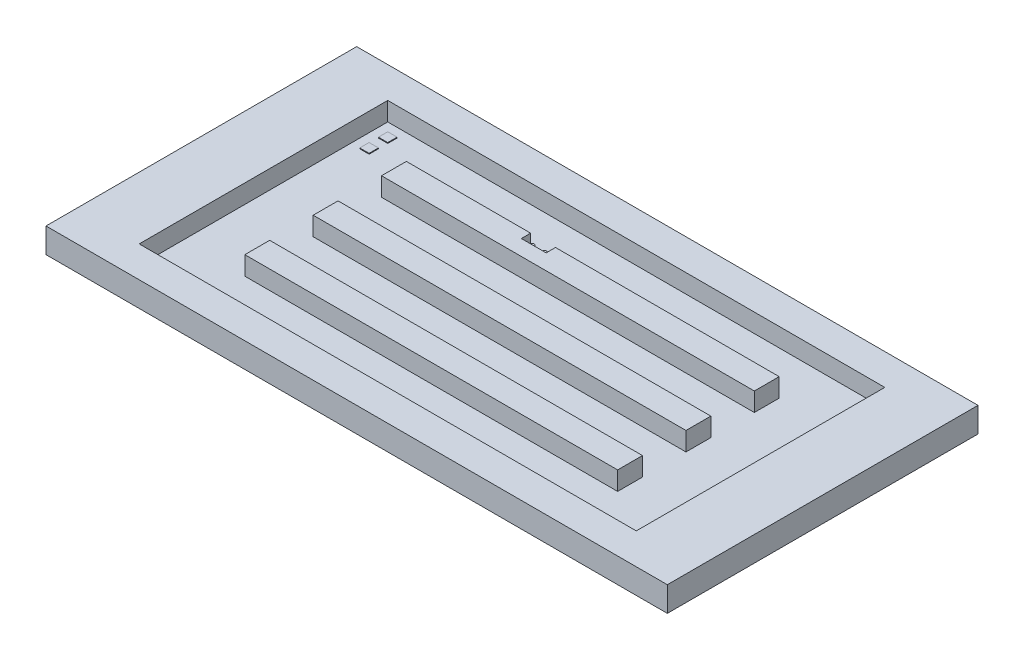
from build123d import *

# Parameters (mm, degrees)
SKETCH_1_W          = 10000
SKETCH_1_H          = 5000
EXTRUDE_1_DEPTH     = 400
SKETCH_2_W          = 8000
SKETCH_2_H          = 4000
SKETCH_2_W_2        = 6000
SKETCH_2_H_2        = 400
CUT_EXTRUDE_2_DEPTH = 300
SKETCH_4_W          = 150
SKETCH_4_H          = 150
EXTRUDE_3_DEPTH     = 13
SKETCH_3_W          = 400
SKETCH_3_H          = 150
CUT_EXTRUDE_4_DEPTH = 200
SKETCH_5_R          = 33
EXTRUDE_5_DEPTH     = 123


with BuildPart() as part:
    # 草圖1 → 伸長1 (new body)
    with BuildSketch(Plane(origin=(0, 0, 0), x_dir=(1, 0, 0), z_dir=(0, 1, 0))):
        Rectangle(SKETCH_1_W, SKETCH_1_H)
    extrude(amount=EXTRUDE_1_DEPTH)

    # 草圖2 → 伸長2 (cut)
    with BuildSketch(Plane(origin=(0, 400, 0), x_dir=(1, 0, 0), z_dir=(0, 1, 0))):
        Rectangle(SKETCH_2_W, SKETCH_2_H)
        with Locations((0, 1100)):
            Rectangle(SKETCH_2_W_2, SKETCH_2_H_2, mode=Mode.SUBTRACT)
        Rectangle(SKETCH_2_W_2, SKETCH_2_H_2, mode=Mode.SUBTRACT)
        with Locations((0, -1100)):
            Rectangle(SKETCH_2_W_2, SKETCH_2_H_2, mode=Mode.SUBTRACT)
    extrude(amount=-CUT_EXTRUDE_2_DEPTH, mode=Mode.SUBTRACT)

    # 草圖4 → 伸長3 (add)
    with BuildSketch(Plane(origin=(0, 100, 0), x_dir=(1, 0, 0), z_dir=(0, 1, 0))):
        with Locations((-3775, 1775)):
            Rectangle(SKETCH_4_W, SKETCH_4_H)
        with Locations((-3775, 1475)):
            Rectangle(SKETCH_4_W, SKETCH_4_H)
    extrude(amount=EXTRUDE_3_DEPTH)

    # 草圖3 → 伸長4 (cut)
    with BuildSketch(Plane(origin=(0, 400, 0), x_dir=(1, 0, 0), z_dir=(0, 1, 0))):
        with Locations((-800, 1225)):
            Rectangle(SKETCH_3_W, SKETCH_3_H)
    extrude(amount=-CUT_EXTRUDE_4_DEPTH, mode=Mode.SUBTRACT)

    # 草圖5 → 伸長5 (add)
    with BuildSketch(Plane(origin=(0, 200, 0), x_dir=(1, 0, 0), z_dir=(0, 1, 0))):
        with Locations(Location((-900, 1221.986986265, 0), (0, 0, 270))):
            Circle(SKETCH_5_R)
        with Locations(Location((-700, 1221.986986265, 0), (0, 0, 270))):
            Circle(SKETCH_5_R)
    extrude(amount=EXTRUDE_5_DEPTH)


solid = part.part
